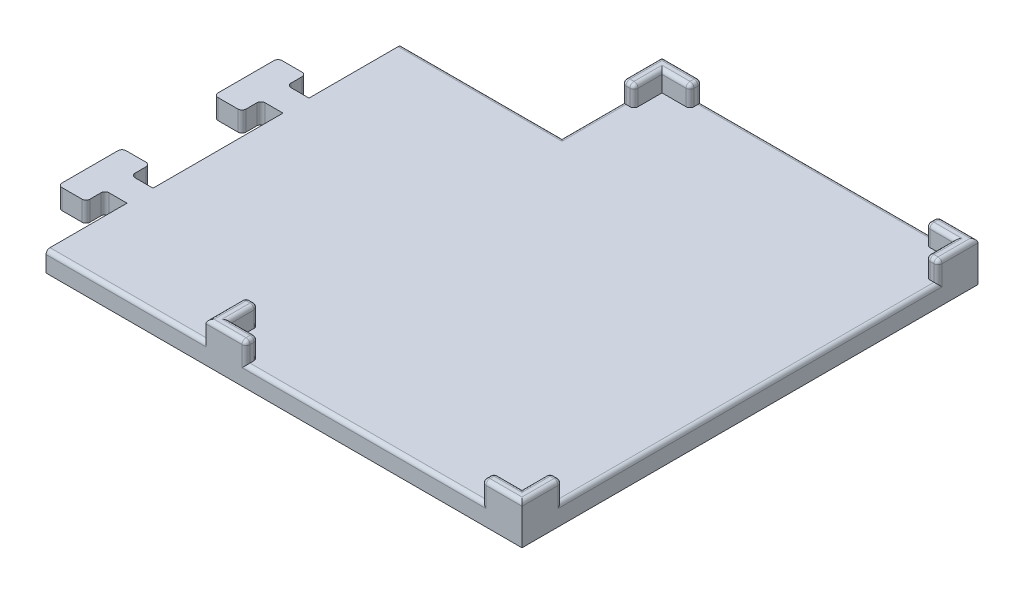
from build123d import *

# Parameters (mm, degrees)
SKETCH1_W           = 79
SKETCH1_H           = 114
BOSS_EXTRUDE1_DEPTH = 5
BOSS_EXTRUDE2_DEPTH = 5
FILLET1_R           = 1
SKETCH3_W           = 89
SKETCH3_H           = 5
BOSS_EXTRUDE3_DEPTH = 40
BOSS_EXTRUDE4_DEPTH = 5
FILLET2_R           = 1
FILLET3_R           = 1


with BuildPart() as part:
    # Sketch1 → Boss-Extrude1 (new body)
    with BuildSketch(Plane(origin=(0, 0, 0), x_dir=(1, 0, 0), z_dir=(0, 1, 0))):
        with Locations((39.5, 57)):
            Rectangle(SKETCH1_W, SKETCH1_H)
    extrude(amount=BOSS_EXTRUDE1_DEPTH)

    # Sketch2 → Boss-Extrude2 (add)
    with BuildSketch(Plane(origin=(0, 5, 0), x_dir=(1, 0, 0), z_dir=(0, 1, 0))):
        Polygon((0, 0), (0, 10), (3, 10), (3, 3), (10, 3), (10, 0), align=None)
        Polygon((79, 0), (69, 0), (69, 3), (76, 3), (76, 10), (79, 10), align=None)
        Polygon((79, 114), (69, 114), (69, 111), (76, 111), (76, 104), (79, 104), align=None)
        Polygon((0, 114), (0, 104), (3, 104), (3, 111), (10, 111), (10, 114), align=None)
    extrude(amount=BOSS_EXTRUDE2_DEPTH)

    # Fillet1
    fillet1_edges = [part.edges().sort_by_distance(p)[0] for p in [
        (74, 10, 0),
        (79, 10, -5),
        (77.5, 10, -10),
        (76, 10, -6.5),
        (72.5, 10, -3),
        (69, 10, -1.5),
        (69, 7.5, 0),
        (69, 7.5, -3),
        (76, 7.5, -10),
        (79, 7.5, -10),
        (79, 10, -109),
        (74, 10, -114),
        (69, 10, -112.5),
        (72.5, 10, -111),
        (76, 10, -107.5),
        (77.5, 10, -104),
        (79, 7.5, -104),
        (76, 7.5, -104),
        (69, 7.5, -111),
        (69, 7.5, -114),
        (10, 7.5, -111),
        (3, 7.5, -104),
        (10, 7.5, -114),
        (0, 7.5, -104),
        (1.5, 10, -104),
        (10, 10, -112.5),
        (6.5, 10, -111),
        (5, 10, -114),
        (3, 10, -107.5),
        (0, 10, -109),
        (3, 7.5, -10),
        (0, 7.5, -10),
        (10, 7.5, -3),
        (10, 7.5, 0),
        (10, 10, -1.5),
        (1.5, 10, -10),
        (6.5, 10, -3),
        (3, 10, -6.5),
        (0, 10, -5),
        (5, 10, 0),
    ]]
    fillet(fillet1_edges, radius=FILLET1_R)

    # Sketch3 → Boss-Extrude3 (add)
    with BuildSketch(Plane.ZY):
        with Locations((-44.5, 2.5)):
            Rectangle(SKETCH3_W, SKETCH3_H)
    extrude(amount=BOSS_EXTRUDE3_DEPTH)

    # Sketch4 → Boss-Extrude4 (add)
    with BuildSketch(Plane(origin=(0, 5, 0), x_dir=(1, 0, 0), z_dir=(0, 1, 0))):
        Polygon((-45.5, 59.25), (-40, 59.25), (-40, 65.75), (-45.5, 65.75), (-45.5, 70.5), (-52.5, 70.5), (-52.5, 54.5), (-45.5, 54.5), align=None)
        Polygon((-45.5, 20.25), (-40, 20.25), (-40, 26.75), (-45.5, 26.75), (-45.5, 31.5), (-52.5, 31.5), (-52.5, 15.5), (-45.5, 15.5), align=None)
    extrude(amount=-BOSS_EXTRUDE4_DEPTH)

    # Fillet2
    fillet2_edges = [part.edges().sort_by_distance(p)[0] for p in [
        (-52.5, 2.5, -70.5),
        (-45.5, 2.5, -70.5),
        (-45.5, 2.5, -65.75),
        (-45.5, 2.5, -59.25),
        (-45.5, 2.5, -54.5),
        (-52.5, 2.5, -54.5),
        (-45.5, 2.5, -26.75),
        (-45.5, 2.5, -31.5),
        (-52.5, 2.5, -31.5),
        (-52.5, 2.5, -15.5),
        (-45.5, 2.5, -15.5),
        (-45.5, 2.5, -20.25),
    ]]
    fillet(fillet2_edges, radius=FILLET2_R)

    # Fillet3
    fillet3_edges = [part.edges().sort_by_distance(p)[0] for p in [
        (-20, 5, -89),
        (0, 5, -97),
        (39.5, 5, -114),
        (79, 5, -57),
        (39.5, 5, 0),
        (-20, 5, 0),
    ]]
    fillet(fillet3_edges, radius=FILLET3_R)


solid = part.part
